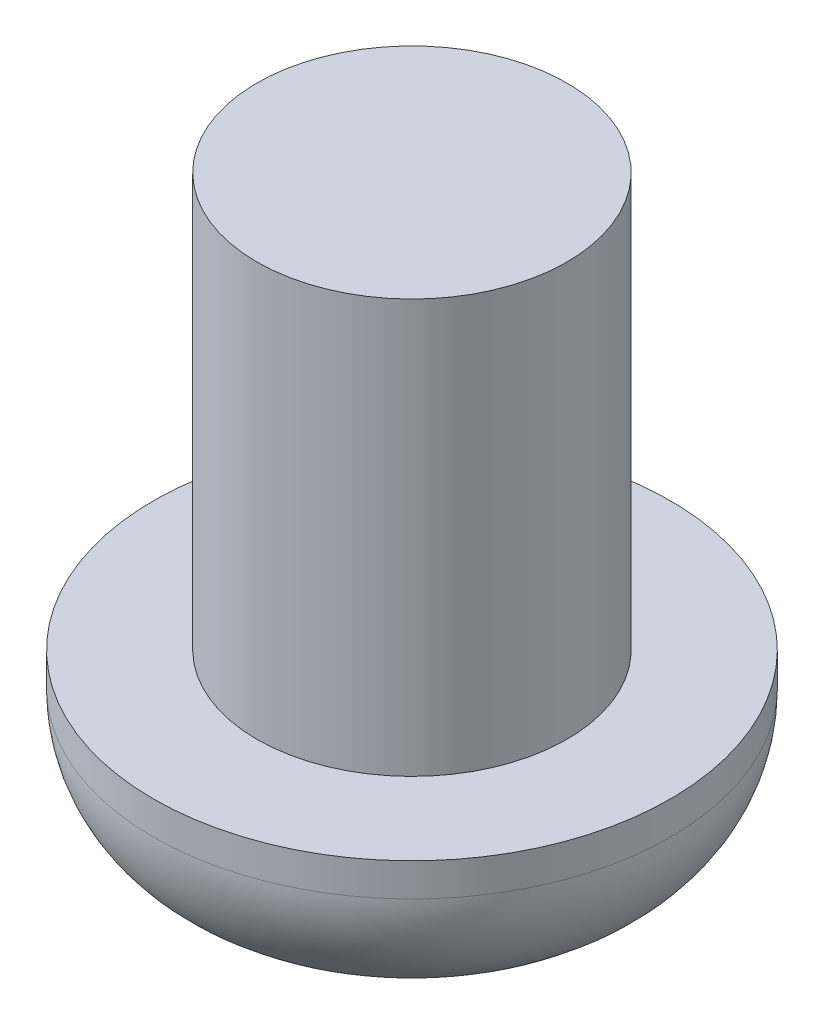
from build123d import *

# Parameters (mm, degrees)
SKETCH1_R                = 3.96875
SKETCH1_R_2              = 2.38125
BOSS_EXTRUDE2_DEPTH      = 2.54
BOSS_EXTRUDE3_DEPTH      = 6.35
BOSS_EXTRUDE3_DEPTH_BACK = 2.54
SKETCH2_R                = 2.38125
SKETCH3_R                = 1.5875
CUT_EXTRUDE1_DEPTH       = 3.175
FILLET1_R                = 2.032
FILLET2_R                = 0.508


with BuildPart() as part:
    # Sketch1 → Boss-Extrude2 (new body)
    with BuildSketch(Plane(origin=(0, 0, 0), x_dir=(1, 0, 0), z_dir=(0, 1, 0))):
        with Locations(Location((0, 0, 0), (0, 0, 270))):
            Circle(SKETCH1_R)
        with Locations(Location((0, 0, 0), (0, 0, 270))):
            Circle(SKETCH1_R_2, mode=Mode.SUBTRACT)
    extrude(amount=BOSS_EXTRUDE2_DEPTH)

    # Sketch2 → Boss-Extrude3 (add, two sides: drawn at the far end of the back side and taken through both)
    with BuildSketch(Plane(origin=(0, 2.54, 0), x_dir=(1, 0, 0), z_dir=(0, 1, 0)).offset(-BOSS_EXTRUDE3_DEPTH_BACK)):
        with Locations(Location((0, 0, 0), (0, 0, 270))):
            Circle(SKETCH2_R)
    extrude(amount=BOSS_EXTRUDE3_DEPTH + BOSS_EXTRUDE3_DEPTH_BACK)

    # Sketch3 → Cut-Extrude1 (cut)
    with BuildSketch(Plane(origin=(0, 0, 0), x_dir=(-1, 0, 0), z_dir=(0, -1, 0))):
        with Locations(Location((0, 0, 0), (0, 0, 90))):
            Circle(SKETCH3_R)
    extrude(amount=-CUT_EXTRUDE1_DEPTH, mode=Mode.SUBTRACT)

    # Fillet1
    fillet1_edges = [part.edges().sort_by_distance(p)[0] for p in [
        (0, 0, -3.96875),
    ]]
    fillet(fillet1_edges, radius=FILLET1_R)

    # Fillet2
    fillet2_edges = [part.edges().sort_by_distance(p)[0] for p in [
        (0, 0, 1.5875),
    ]]
    fillet(fillet2_edges, radius=FILLET2_R)


solid = part.part
